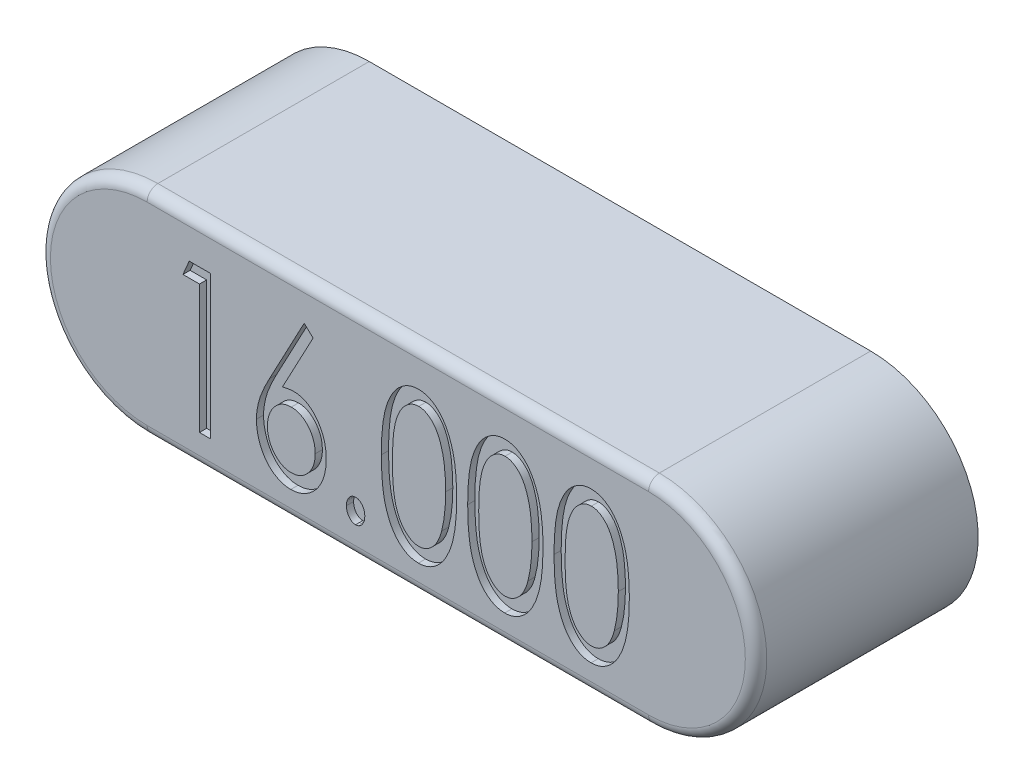
from build123d import *

# Parameters (mm, degrees)
BOSS_EXTRU_1_DEPTH      = 3.1
CONG_1_R                = 0.15
ENL_V_MAT_EXTRU_1_DEPTH = 0.1


with BuildPart() as part:
    # Esquisse1 → Boss.-Extru.1 (new body)
    with BuildSketch(Plane.XY):
        with BuildLine():
            Line((-3.5, 1.5), (3.5, 1.5))
            ThreePointArc((3.5, 1.5), (5, 0), (3.5, -1.5))
            Line((3.5, -1.5), (-3.5, -1.5))
            ThreePointArc((-3.5, -1.5), (-5, 0), (-3.5, 1.5))
        make_face()
    extrude(amount=BOSS_EXTRU_1_DEPTH)

    # Congé1
    cong_1_edges = [part.edges().sort_by_distance(p)[0] for p in [
        (5, 0, 3.1),
        (0, 1.5, 3.1),
        (-5, 0, 3.1),
        (0, -1.5, 3.1),
    ]]
    fillet(cong_1_edges, radius=CONG_1_R)

    # Esquisse2 → Enlèv. mat.-Extru.1 (cut)
    # profile 1 of 6: a face of its own
    with BuildSketch(Plane.XY.offset(3.1)):
        Polygon((-2.912259615, 0.930524366), (-2.615384615, 0.930524366), (-2.615384615, -1.069475634), (-2.769230769, -1.069475634), (-2.769230769, 0.725396161), (-3, 0.725396161), align=None)
    # profile 2 of 6: a face of its own
    with BuildSketch(Plane.XY.offset(3.1)):
        with BuildLine():
            Line((-1.307692308, 0.981806417), (-1.18349359, 0.864819238))
            Line((-1.18349359, 0.864819238), (-1.611778846, 0.059530776))
            add(Edge.make_bspline(
                [(-1.611778846, 0.059530776), (-1.597928908, 0.063290971), (-1.57080734, 0.070654352), (-1.530316189, 0.078859667), (-1.490751869, 0.083287154), (-1.464753301, 0.084012543), (-1.451923077, 0.08437052)],
                knots=[0, 0, 0, 0, 1.060929787, 2.077560185, 3.051281057, 4, 4, 4, 4], degree=3))
            add(Edge.make_bspline(
                [(-1.451923077, 0.08437052), (-1.436395077, 0.083823186), (-1.405796534, 0.082744643), (-1.360996018, 0.074440897), (-1.317979302, 0.061238797), (-1.276929721, 0.042085793), (-1.237486989, 0.017974526), (-1.199910734, -0.011674731), (-1.164291733, -0.046676576), (-1.130905893, -0.086633183), (-1.1003596, -0.130333468), (-1.073282455, -0.176863233), (-1.051006845, -0.226156239), (-1.031859912, -0.27755602), (-1.017498053, -0.331780281), (-1.007812544, -0.388522634), (-1.000953164, -0.447514582), (-1.00032137, -0.487724375), (-1, -0.508177557)],
                knots=[0, 0, 0, 0, 0.901205013, 1.775860311, 2.636794131, 3.507728647, 4.39883402, 5.315685146, 6.280851143, 7.293630634, 8.33489768, 9.373736179, 10.414743294, 11.472171862, 12.555667919, 13.666163363, 14.812866618, 16, 16, 16, 16], degree=3))
            add(Edge.make_bspline(
                [(-1, -0.508177557), (-1.0007265, -0.536136644), (-1.002151756, -0.590987107), (-1.014610645, -0.670985406), (-1.034016283, -0.747191508), (-1.062116334, -0.818436072), (-1.096679504, -0.884517409), (-1.138789477, -0.94363876), (-1.187547363, -0.995687146), (-1.242264715, -1.040061564), (-1.301420233, -1.075822064), (-1.363712467, -1.101873665), (-1.428572353, -1.117683073), (-1.472671307, -1.119730621), (-1.494791667, -1.120757685)],
                knots=[0, 0, 0, 0, 1.1494067, 2.254919458, 3.322155787, 4.377964422, 5.397776209, 6.382466747, 7.354045797, 8.32263862, 9.271321606, 10.187430282, 11.090801708, 12, 12, 12, 12], degree=3))
            add(Edge.make_bspline(
                [(-1.494791667, -1.120757685), (-1.516248987, -1.119893133), (-1.558757205, -1.118180403), (-1.621133397, -1.102527391), (-1.680863317, -1.07737479), (-1.737845052, -1.042871974), (-1.79033411, -0.999083768), (-1.837141275, -0.946681866), (-1.8781977, -0.886485515), (-1.912693623, -0.818990005), (-1.939971184, -0.746329722), (-1.959627687, -0.67031336), (-1.972134161, -0.59192464), (-1.97361248, -0.538673221), (-1.974358974, -0.511783326)],
                knots=[0, 0, 0, 0, 0.896664654, 1.776345551, 2.673079863, 3.600831316, 4.55320042, 5.522713429, 6.531813274, 7.594061508, 8.687030288, 9.772760072, 10.875330519, 12, 12, 12, 12], degree=3))
            add(Edge.make_bspline(
                [(-1.974358974, -0.511783326), (-1.973908663, -0.491194414), (-1.972990466, -0.449213115), (-1.964915054, -0.385628312), (-1.952435643, -0.320472169), (-1.934913788, -0.252807089), (-1.910935911, -0.180965122), (-1.878612722, -0.103564516), (-1.839513869, -0.018921149), (-1.808918787, 0.038843036), (-1.79286859, 0.069146161)],
                knots=[0, 0, 0, 0, 0.803132881, 1.63760775, 2.497139017, 3.390748782, 4.363024246, 5.449780174, 6.662153211, 8, 8, 8, 8], degree=3))
            Line((-1.79286859, 0.069146161), (-1.307692308, 0.981806417))
        make_face()
        with BuildLine():
            add(Edge.make_bspline(
                [(-1.487179487, -0.120757685), (-1.498547668, -0.121199377), (-1.52086876, -0.122066626), (-1.553887307, -0.12726169), (-1.585363377, -0.136644451), (-1.615926525, -0.149010427), (-1.644800356, -0.165736567), (-1.672584442, -0.185736864), (-1.698714808, -0.209838797), (-1.723631875, -0.236653675), (-1.746540205, -0.266147466), (-1.765932663, -0.297939868), (-1.783086863, -0.330855512), (-1.796585801, -0.365585147), (-1.807558617, -0.401704667), (-1.815069849, -0.439411738), (-1.819548224, -0.478688686), (-1.82018654, -0.505361057), (-1.820512821, -0.518994865)],
                knots=[0, 0, 0, 0, 0.946268867, 1.857971231, 2.772378949, 3.674274847, 4.595075925, 5.54206238, 6.517636006, 7.547827487, 8.585901374, 9.619025919, 10.642903972, 11.670634825, 12.714877187, 13.780659826, 14.865565546, 16, 16, 16, 16], degree=3))
            add(Edge.make_bspline(
                [(-1.820512821, -0.518994865), (-1.820190003, -0.532496), (-1.819558583, -0.558903747), (-1.815018142, -0.597901321), (-1.807636957, -0.635374592), (-1.796484507, -0.671302006), (-1.783203453, -0.705857083), (-1.76580999, -0.738517907), (-1.746557162, -0.770248932), (-1.723625671, -0.799727857), (-1.69872246, -0.826561282), (-1.672561444, -0.85060729), (-1.644934681, -0.870765193), (-1.615706736, -0.886791849), (-1.585481527, -0.899881014), (-1.553869055, -0.90908468), (-1.520873519, -0.914331178), (-1.498549275, -0.915191378), (-1.487179487, -0.91562948)],
                knots=[0, 0, 0, 0, 1.126413976, 2.203226288, 3.27193519, 4.308375719, 5.338928357, 6.355711774, 7.391672913, 8.432596984, 9.465617006, 10.443869212, 11.393455756, 12.311321693, 13.22000908, 14.136927438, 15.051133013, 16, 16, 16, 16], degree=3))
            add(Edge.make_bspline(
                [(-1.487179487, -0.91562948), (-1.475811589, -0.91518575), (-1.453491053, -0.914314498), (-1.420595486, -0.909168517), (-1.389083992, -0.899688132), (-1.358812993, -0.88701544), (-1.329750225, -0.870641367), (-1.302189255, -0.850481251), (-1.275636518, -0.826830561), (-1.251146695, -0.799582514), (-1.22824051, -0.770149978), (-1.208487633, -0.738637771), (-1.191181015, -0.705841693), (-1.177867561, -0.671306175), (-1.166723936, -0.635373435), (-1.159340311, -0.597901636), (-1.15480053, -0.558903664), (-1.154169018, -0.532495972), (-1.153846154, -0.518994865)],
                knots=[0, 0, 0, 0, 0.949074805, 1.863480608, 2.76990316, 3.689052114, 4.597391575, 5.547186095, 6.533934344, 7.559637911, 8.600789962, 9.642896214, 10.659902324, 11.690680672, 12.727348199, 13.796291166, 14.87333932, 16, 16, 16, 16], degree=3))
            add(Edge.make_bspline(
                [(-1.153846154, -0.518994865), (-1.154172482, -0.505361086), (-1.15481089, -0.478688771), (-1.159288599, -0.43941142), (-1.16680228, -0.401705828), (-1.177766199, -0.365580936), (-1.19129766, -0.330870939), (-1.208363527, -0.297819178), (-1.228257402, -0.266246379), (-1.251140542, -0.236799056), (-1.275644221, -0.209569491), (-1.302165749, -0.185862376), (-1.329885659, -0.165859651), (-1.358592828, -0.148787188), (-1.389200047, -0.136834877), (-1.420577543, -0.1271783), (-1.453495755, -0.12208324), (-1.475813175, -0.121204984), (-1.487179487, -0.120757685)],
                knots=[0, 0, 0, 0, 1.134674697, 2.21981017, 3.285818513, 4.330282017, 5.358230516, 6.382325399, 7.421570703, 8.459864426, 9.482752076, 10.466791355, 11.413978355, 12.325331643, 13.237701197, 14.141635301, 15.053530739, 16, 16, 16, 16], degree=3))
        make_face(mode=Mode.SUBTRACT)
    # profile 3 of 6: a face of its own
    with BuildSketch(Plane.XY.offset(3.1)):
        with BuildLine():
            add(Edge.make_bspline(
                [(-0.58974359, -0.761783326), (-0.581123113, -0.762443269), (-0.564086626, -0.763747501), (-0.539531636, -0.772992058), (-0.517565815, -0.78886606), (-0.498202002, -0.810156431), (-0.482075792, -0.835546443), (-0.469642782, -0.863958906), (-0.462939804, -0.89542371), (-0.4620157, -0.917202623), (-0.461538462, -0.928449993)],
                knots=[0, 0, 0, 0, 0.888235515, 1.755403159, 2.664739847, 3.658771767, 4.705496901, 5.754303631, 6.840246125, 8, 8, 8, 8], degree=3))
            add(Edge.make_bspline(
                [(-0.461538462, -0.928449993), (-0.462033703, -0.939427849), (-0.463003918, -0.960934279), (-0.46962265, -0.992151355), (-0.482191598, -1.02061416), (-0.498072405, -1.046283442), (-0.517563963, -1.067665176), (-0.539618944, -1.083402668), (-0.563994713, -1.093265343), (-0.581108259, -1.094495789), (-0.58974359, -1.09511666)],
                knots=[0, 0, 0, 0, 1.133833385, 2.221263238, 3.271506465, 4.33130329, 5.326696684, 6.237278843, 7.110547914, 8, 8, 8, 8], degree=3))
            add(Edge.make_bspline(
                [(-0.58974359, -1.09511666), (-0.598383178, -1.094501776), (-0.615505164, -1.093283196), (-0.639920517, -1.083289415), (-0.662304833, -1.067819227), (-0.681769076, -1.046249295), (-0.697800478, -1.02071797), (-0.709748667, -0.992045599), (-0.716517066, -0.960948861), (-0.7174649, -0.939432777), (-0.717948718, -0.928449993)],
                knots=[0, 0, 0, 0, 0.888790314, 1.761409654, 2.682617918, 3.677270718, 4.73627903, 5.78038943, 6.867010211, 8, 8, 8, 8], degree=3))
            add(Edge.make_bspline(
                [(-0.717948718, -0.928449993), (-0.717483324, -0.917197514), (-0.716582156, -0.895408708), (-0.709728509, -0.864064667), (-0.697914313, -0.835443547), (-0.681639779, -0.810190286), (-0.66230316, -0.788712007), (-0.6400088, -0.773103073), (-0.615413297, -0.763729497), (-0.598368348, -0.76243722), (-0.58974359, -0.761783326)],
                knots=[0, 0, 0, 0, 1.158892172, 2.244027806, 3.286711158, 4.33265857, 5.32595192, 6.245901114, 7.112424448, 8, 8, 8, 8], degree=3))
        make_face()
    # profile 4 of 6: a face of its own
    with BuildSketch(Plane.XY.offset(3.1)):
        with BuildLine():
            add(Edge.make_bspline(
                [(-0.230769231, -0.070276916), (-0.230474041, -0.038224399), (-0.229900769, 0.024023022), (-0.227325681, 0.114747379), (-0.222082415, 0.19984573), (-0.214965122, 0.279352934), (-0.205833695, 0.353130467), (-0.194712439, 0.421316523), (-0.181602846, 0.483916277), (-0.166368729, 0.541305017), (-0.148839801, 0.594118989), (-0.130311421, 0.643519845), (-0.109197208, 0.68937324), (-0.086957603, 0.73208806), (-0.0632601, 0.771725069), (-0.037764758, 0.807961446), (-0.009737823, 0.840280268), (0.018789809, 0.870290463), (0.049436254, 0.895982359), (0.080269299, 0.91926715), (0.112490083, 0.938624782), (0.145791303, 0.954062328), (0.179588951, 0.966785605), (0.214375425, 0.975605152), (0.250096609, 0.980981758), (0.274286828, 0.981530376), (0.286458333, 0.981806417)],
                knots=[0, 0, 0, 0, 1.781901398, 3.460532095, 5.044788518, 6.520804026, 7.897452363, 9.176538264, 10.360312765, 11.451616863, 12.475215169, 13.452762962, 14.382988646, 15.279574158, 16.128804228, 16.948678406, 17.738629264, 18.505137989, 19.247576026, 19.958810054, 20.651434701, 21.332261274, 21.996989992, 22.656014566, 23.323762819, 24, 24, 24, 24], degree=3))
            add(Edge.make_bspline(
                [(0.286458333, 0.981806417), (0.298762963, 0.981525699), (0.323350436, 0.980964761), (0.359730982, 0.97559432), (0.395211685, 0.966861046), (0.429517191, 0.954052873), (0.463243244, 0.938657556), (0.495862586, 0.919122873), (0.527619541, 0.896188666), (0.558332067, 0.869683251), (0.588278699, 0.839993784), (0.616141899, 0.806337369), (0.642115369, 0.769121056), (0.667269704, 0.728947461), (0.690200888, 0.684864132), (0.711958668, 0.637430776), (0.731892982, 0.586431172), (0.75043375, 0.531817858), (0.766880081, 0.472975065), (0.781190339, 0.409578105), (0.793631441, 0.341431017), (0.803561565, 0.268435077), (0.810993083, 0.190502091), (0.816645047, 0.107811556), (0.81975083, 0.020291786), (0.820254377, -0.039558828), (0.820512821, -0.070276916)],
                knots=[0, 0, 0, 0, 0.680015622, 1.358827319, 2.028662734, 2.696786366, 3.380680169, 4.075961124, 4.795334018, 5.544232778, 6.317033788, 7.124480586, 7.956310745, 8.825174656, 9.743468946, 10.701748025, 11.709644056, 12.76982753, 13.889669025, 15.086322274, 16.362388274, 17.718987041, 19.158433838, 20.690516929, 22.301421041, 24, 24, 24, 24], degree=3))
            add(Edge.make_bspline(
                [(0.820512821, -0.070276916), (0.820268425, -0.100862364), (0.819792302, -0.16044773), (0.816493887, -0.247545999), (0.811521084, -0.329870804), (0.803959205, -0.407389783), (0.793946241, -0.479944781), (0.781918533, -0.54783589), (0.768226441, -0.61105659), (0.751641789, -0.669577198), (0.733001738, -0.723694285), (0.713563922, -0.774563749), (0.691809097, -0.821820457), (0.668732844, -0.865941267), (0.643871249, -0.906523818), (0.617344, -0.943716027), (0.588942719, -0.977221793), (0.559295974, -1.007463697), (0.528230057, -1.03399666), (0.49646204, -1.057241223), (0.463527393, -1.076696729), (0.429927832, -1.092789073), (0.395306298, -1.105337064), (0.359700197, -1.114032606), (0.323387547, -1.120042905), (0.298768797, -1.120519411), (0.286458333, -1.120757685)],
                knots=[0, 0, 0, 0, 1.693248669, 3.298720394, 4.82480384, 6.258640445, 7.609562187, 8.878591748, 10.075077288, 11.189162254, 12.243632055, 13.243172686, 14.20261538, 15.122024733, 15.998236071, 16.835364342, 17.64854462, 18.427529536, 19.177337665, 19.907907745, 20.604032963, 21.291903361, 21.967788968, 22.638437747, 23.319158652, 24, 24, 24, 24], degree=3))
            add(Edge.make_bspline(
                [(0.286458333, -1.120757685), (0.274285631, -1.120490882), (0.250225251, -1.119963521), (0.214522416, -1.114477353), (0.17978066, -1.105723578), (0.14591644, -1.093493428), (0.112750732, -1.078478613), (0.081119766, -1.058697557), (0.049852519, -1.036476497), (0.019667589, -1.010630587), (-0.009128207, -0.98151146), (-0.036074448, -0.948610477), (-0.061765232, -0.9125463), (-0.08565008, -0.872994927), (-0.10769828, -0.830040979), (-0.128736215, -0.78407815), (-0.147147523, -0.734194198), (-0.165209665, -0.681079961), (-0.18077863, -0.623270996), (-0.194420678, -0.560317626), (-0.205395991, -0.491804816), (-0.214422135, -0.418012717), (-0.222240127, -0.33882441), (-0.227280257, -0.254095372), (-0.229909133, -0.163910288), (-0.230477253, -0.102062723), (-0.230769231, -0.070276916)],
                knots=[0, 0, 0, 0, 0.677096952, 1.338339662, 2.005406211, 2.668443115, 3.340255766, 4.027397533, 4.741163398, 5.474065193, 6.236238345, 7.017634829, 7.838551399, 8.699067334, 9.586765462, 10.524942004, 11.510680007, 12.54497159, 13.646778121, 14.840882375, 16.128929706, 17.507328321, 18.978512682, 20.55736376, 22.230698808, 24, 24, 24, 24], degree=3))
        make_face()
        with BuildLine():
            add(Edge.make_bspline(
                [(-0.076923077, -0.069475634), (-0.07673755, -0.096185838), (-0.076377576, -0.148011256), (-0.074514557, -0.223358014), (-0.070839305, -0.293612484), (-0.06619436, -0.358828298), (-0.059860058, -0.418972591), (-0.051860858, -0.474149384), (-0.042759225, -0.52429389), (-0.032316203, -0.569786533), (-0.020255431, -0.611383299), (-0.006504203, -0.649946531), (0.008195613, -0.68597737), (0.024220335, -0.719521268), (0.04192703, -0.750343808), (0.060628192, -0.778838648), (0.080788143, -0.804774429), (0.108986226, -0.83489419), (0.145759252, -0.866655444), (0.192916203, -0.89453742), (0.24156396, -0.912241886), (0.27483534, -0.914509597), (0.291266026, -0.91562948)],
                knots=[0, 0, 0, 0, 1.585253382, 3.075843952, 4.472619842, 5.760128673, 6.955753547, 8.06095077, 9.068316143, 9.979618947, 10.829906407, 11.637100979, 12.408357834, 13.138614022, 13.841518553, 14.516382118, 15.160087741, 15.788184859, 16.963380614, 18.029108162, 19.026697924, 20, 20, 20, 20], degree=3))
            add(Edge.make_bspline(
                [(0.291266026, -0.91562948), (0.307838889, -0.914695182), (0.341276709, -0.912810118), (0.389629906, -0.8949691), (0.43638352, -0.867927089), (0.472479108, -0.83676057), (0.5001326, -0.807170794), (0.520010708, -0.781578846), (0.538214817, -0.753137518), (0.555416558, -0.722206592), (0.571720432, -0.688782825), (0.585775022, -0.652312701), (0.599199523, -0.613336894), (0.606715719, -0.58621376), (0.610576923, -0.572280121)],
                knots=[0, 0, 0, 0, 1.179950538, 2.380697451, 3.63736744, 5.024996919, 5.767521967, 6.528927784, 7.335999231, 8.177356486, 9.056327879, 9.989928685, 10.967390406, 12, 12, 12, 12], degree=3))
            add(Edge.make_bspline(
                [(0.610576923, -0.572280121), (0.615156046, -0.55442452), (0.624472529, -0.518096291), (0.635460857, -0.461742143), (0.645034226, -0.402948779), (0.653166832, -0.341510098), (0.65900301, -0.277342738), (0.663365769, -0.210414236), (0.666332226, -0.140816385), (0.666553961, -0.093517225), (0.666666667, -0.069475634)],
                knots=[0, 0, 0, 0, 0.8718959, 1.773921478, 2.714952333, 3.689817886, 4.705117713, 5.762496763, 6.862704138, 8, 8, 8, 8], degree=3))
            add(Edge.make_bspline(
                [(0.666666667, -0.069475634), (0.666514887, -0.04543552), (0.666217995, 0.001588811), (0.663845848, 0.070394625), (0.659674861, 0.135827953), (0.654849267, 0.198017104), (0.647345479, 0.256741752), (0.639314604, 0.312306898), (0.628614562, 0.364328192), (0.617281343, 0.413352745), (0.60389425, 0.45881603), (0.590021525, 0.50134345), (0.574374009, 0.54048747), (0.557651146, 0.576679437), (0.539535265, 0.609493906), (0.520836273, 0.639519813), (0.500341447, 0.666008965), (0.472095546, 0.696243498), (0.435313587, 0.727539901), (0.38904814, 0.756180368), (0.340478053, 0.773151342), (0.307545822, 0.775511491), (0.291266026, 0.776678212)],
                knots=[0, 0, 0, 0, 1.427519131, 2.792338422, 4.087386796, 5.320879155, 6.495321347, 7.602283647, 8.653622338, 9.64806089, 10.589215667, 11.466924906, 12.303360749, 13.090967005, 13.832724313, 14.527915986, 15.189360817, 15.817798831, 16.982454729, 18.045985158, 19.034047716, 20, 20, 20, 20], degree=3))
            add(Edge.make_bspline(
                [(0.291266026, 0.776678212), (0.274717547, 0.775525135), (0.241386837, 0.773202695), (0.192305804, 0.75618145), (0.145672523, 0.727665065), (0.108966317, 0.696377285), (0.081071352, 0.666471158), (0.061054256, 0.640675695), (0.042256702, 0.612308836), (0.025108859, 0.581246909), (0.008961616, 0.547846643), (-0.005685417, 0.511789271), (-0.019488637, 0.473242339), (-0.031393515, 0.431576139), (-0.042514711, 0.386211788), (-0.051362001, 0.336114848), (-0.05957319, 0.280970928), (-0.065645371, 0.220654519), (-0.070970271, 0.155350209), (-0.074490385, 0.084938174), (-0.076385799, 0.009461392), (-0.076740365, -0.04263161), (-0.076923077, -0.069475634)],
                knots=[0, 0, 0, 0, 0.981108698, 1.976075909, 3.045759451, 4.209702925, 4.826555694, 5.470216713, 6.145033515, 6.843991151, 7.574196738, 8.345400151, 9.15253879, 10.002767331, 10.915831776, 11.923127346, 13.020405197, 14.223828133, 15.519757537, 16.90852172, 18.406931538, 20, 20, 20, 20], degree=3))
        make_face(mode=Mode.SUBTRACT)
    # profile 5 of 6: a face of its own
    with BuildSketch(Plane.XY.offset(3.1)):
        with BuildLine():
            add(Edge.make_bspline(
                [(0.974358974, -0.070276916), (0.974654164, -0.038224399), (0.975227436, 0.024023022), (0.977802524, 0.114747379), (0.98304579, 0.19984573), (0.990163083, 0.279352934), (0.99929451, 0.353130467), (1.010415766, 0.421316523), (1.023525359, 0.483916277), (1.038759477, 0.541305017), (1.056288404, 0.594118989), (1.074816785, 0.643519845), (1.095930997, 0.68937324), (1.118170602, 0.73208806), (1.141868105, 0.771725069), (1.167363448, 0.807961446), (1.195390382, 0.840280268), (1.223918014, 0.870290463), (1.25456446, 0.895982359), (1.285397504, 0.91926715), (1.317618288, 0.938624782), (1.350919509, 0.954062328), (1.384717156, 0.966785605), (1.41950363, 0.975605152), (1.455224814, 0.980981758), (1.479415033, 0.981530376), (1.491586538, 0.981806417)],
                knots=[0, 0, 0, 0, 1.781901398, 3.460532095, 5.044788518, 6.520804026, 7.897452363, 9.176538264, 10.360312765, 11.451616863, 12.475215169, 13.452762962, 14.382988646, 15.279574158, 16.128804228, 16.948678406, 17.738629264, 18.505137989, 19.247576026, 19.958810054, 20.651434701, 21.332261274, 21.996989992, 22.656014566, 23.323762819, 24, 24, 24, 24], degree=3))
            add(Edge.make_bspline(
                [(1.491586538, 0.981806417), (1.503891168, 0.981525699), (1.528478641, 0.980964761), (1.564859187, 0.97559432), (1.60033989, 0.966861046), (1.634645396, 0.954052873), (1.668371449, 0.938657556), (1.700990791, 0.919122873), (1.732747746, 0.896188666), (1.763460272, 0.869683251), (1.793406904, 0.839993784), (1.821270104, 0.806337369), (1.847243574, 0.769121056), (1.872397909, 0.728947461), (1.895329094, 0.684864132), (1.917086873, 0.637430776), (1.937021187, 0.586431172), (1.955561955, 0.531817858), (1.972008286, 0.472975065), (1.986318545, 0.409578105), (1.998759646, 0.341431017), (2.00868977, 0.268435077), (2.016121288, 0.190502091), (2.021773252, 0.107811556), (2.024879035, 0.020291786), (2.025382582, -0.039558828), (2.025641026, -0.070276916)],
                knots=[0, 0, 0, 0, 0.680015622, 1.358827319, 2.028662734, 2.696786366, 3.380680169, 4.075961124, 4.795334018, 5.544232778, 6.317033788, 7.124480586, 7.956310745, 8.825174656, 9.743468946, 10.701748025, 11.709644056, 12.76982753, 13.889669025, 15.086322274, 16.362388274, 17.718987041, 19.158433838, 20.690516929, 22.301421041, 24, 24, 24, 24], degree=3))
            add(Edge.make_bspline(
                [(2.025641026, -0.070276916), (2.02539663, -0.100862364), (2.024920507, -0.16044773), (2.021622092, -0.247545999), (2.016649289, -0.329870804), (2.00908741, -0.407389783), (1.999074446, -0.479944781), (1.987046738, -0.54783589), (1.973354647, -0.61105659), (1.956769994, -0.669577198), (1.938129943, -0.723694285), (1.918692127, -0.774563749), (1.896937302, -0.821820457), (1.873861049, -0.865941267), (1.848999454, -0.906523818), (1.822472205, -0.943716027), (1.794070924, -0.977221793), (1.764424179, -1.007463697), (1.733358262, -1.03399666), (1.701590245, -1.057241223), (1.668655598, -1.076696729), (1.635056037, -1.092789073), (1.600434504, -1.105337064), (1.564828402, -1.114032606), (1.528515752, -1.120042905), (1.503897002, -1.120519411), (1.491586538, -1.120757685)],
                knots=[0, 0, 0, 0, 1.693248669, 3.298720394, 4.82480384, 6.258640445, 7.609562187, 8.878591748, 10.075077288, 11.189162254, 12.243632055, 13.243172686, 14.20261538, 15.122024733, 15.998236071, 16.835364342, 17.64854462, 18.427529536, 19.177337665, 19.907907745, 20.604032963, 21.291903361, 21.967788968, 22.638437747, 23.319158652, 24, 24, 24, 24], degree=3))
            add(Edge.make_bspline(
                [(1.491586538, -1.120757685), (1.479413836, -1.120490882), (1.455353456, -1.119963521), (1.419650621, -1.114477353), (1.384908865, -1.105723578), (1.351044645, -1.093493428), (1.317878937, -1.078478613), (1.286247971, -1.058697557), (1.254980724, -1.036476497), (1.224795794, -1.010630587), (1.195999998, -0.98151146), (1.169053757, -0.948610477), (1.143362973, -0.9125463), (1.119478125, -0.872994927), (1.097429925, -0.830040979), (1.076391991, -0.78407815), (1.057980682, -0.734194198), (1.03991854, -0.681079961), (1.024349575, -0.623270996), (1.010707527, -0.560317626), (0.999732215, -0.491804816), (0.99070607, -0.418012717), (0.982888078, -0.33882441), (0.977847949, -0.254095372), (0.975219072, -0.163910288), (0.974650952, -0.102062723), (0.974358974, -0.070276916)],
                knots=[0, 0, 0, 0, 0.677096952, 1.338339662, 2.005406211, 2.668443115, 3.340255766, 4.027397533, 4.741163398, 5.474065193, 6.236238345, 7.017634829, 7.838551399, 8.699067334, 9.586765462, 10.524942004, 11.510680007, 12.54497159, 13.646778121, 14.840882375, 16.128929706, 17.507328321, 18.978512682, 20.55736376, 22.230698808, 24, 24, 24, 24], degree=3))
        make_face()
        with BuildLine():
            add(Edge.make_bspline(
                [(1.128205128, -0.069475634), (1.128390655, -0.096185838), (1.128750629, -0.148011256), (1.130613648, -0.223358014), (1.1342889, -0.293612484), (1.138933845, -0.358828298), (1.145268147, -0.418972591), (1.153267348, -0.474149384), (1.16236898, -0.52429389), (1.172812002, -0.569786533), (1.184872774, -0.611383299), (1.198624002, -0.649946531), (1.213323818, -0.68597737), (1.22934854, -0.719521268), (1.247055235, -0.750343808), (1.265756398, -0.778838648), (1.285916348, -0.804774429), (1.314114431, -0.83489419), (1.350887457, -0.866655444), (1.398044409, -0.89453742), (1.446692165, -0.912241886), (1.479963545, -0.914509597), (1.496394231, -0.91562948)],
                knots=[0, 0, 0, 0, 1.585253382, 3.075843952, 4.472619842, 5.760128673, 6.955753547, 8.06095077, 9.068316143, 9.979618947, 10.829906407, 11.637100979, 12.408357834, 13.138614022, 13.841518553, 14.516382118, 15.160087741, 15.788184859, 16.963380614, 18.029108162, 19.026697924, 20, 20, 20, 20], degree=3))
            add(Edge.make_bspline(
                [(1.496394231, -0.91562948), (1.512967094, -0.914695182), (1.546404914, -0.912810118), (1.594758111, -0.8949691), (1.641511725, -0.867927089), (1.677607313, -0.83676057), (1.705260805, -0.807170794), (1.725138914, -0.781578846), (1.743343022, -0.753137518), (1.760544763, -0.722206592), (1.776848637, -0.688782825), (1.790903228, -0.652312701), (1.804327728, -0.613336894), (1.811843924, -0.58621376), (1.815705128, -0.572280121)],
                knots=[0, 0, 0, 0, 1.179950538, 2.380697451, 3.63736744, 5.024996919, 5.767521967, 6.528927784, 7.335999231, 8.177356486, 9.056327879, 9.989928685, 10.967390406, 12, 12, 12, 12], degree=3))
            add(Edge.make_bspline(
                [(1.815705128, -0.572280121), (1.820284251, -0.55442452), (1.829600734, -0.518096291), (1.840589062, -0.461742143), (1.850162431, -0.402948779), (1.858295037, -0.341510098), (1.864131215, -0.277342738), (1.868493974, -0.210414236), (1.871460431, -0.140816385), (1.871682167, -0.093517225), (1.871794872, -0.069475634)],
                knots=[0, 0, 0, 0, 0.8718959, 1.773921478, 2.714952333, 3.689817886, 4.705117713, 5.762496763, 6.862704138, 8, 8, 8, 8], degree=3))
            add(Edge.make_bspline(
                [(1.871794872, -0.069475634), (1.871643092, -0.04543552), (1.8713462, 0.001588811), (1.868974053, 0.070394625), (1.864803066, 0.135827953), (1.859977472, 0.198017104), (1.852473685, 0.256741752), (1.844442809, 0.312306898), (1.833742768, 0.364328192), (1.822409548, 0.413352745), (1.809022455, 0.45881603), (1.79514973, 0.50134345), (1.779502214, 0.54048747), (1.762779351, 0.576679437), (1.74466347, 0.609493906), (1.725964478, 0.639519813), (1.705469652, 0.666008965), (1.677223752, 0.696243498), (1.640441793, 0.727539901), (1.594176345, 0.756180368), (1.545606258, 0.773151342), (1.512674027, 0.775511491), (1.496394231, 0.776678212)],
                knots=[0, 0, 0, 0, 1.427519131, 2.792338422, 4.087386796, 5.320879155, 6.495321347, 7.602283647, 8.653622338, 9.64806089, 10.589215667, 11.466924906, 12.303360749, 13.090967005, 13.832724313, 14.527915986, 15.189360817, 15.817798831, 16.982454729, 18.045985158, 19.034047716, 20, 20, 20, 20], degree=3))
            add(Edge.make_bspline(
                [(1.496394231, 0.776678212), (1.479845752, 0.775525135), (1.446515042, 0.773202695), (1.397434009, 0.75618145), (1.350800728, 0.727665065), (1.314094522, 0.696377285), (1.286199557, 0.666471158), (1.266182461, 0.640675695), (1.247384907, 0.612308836), (1.230237064, 0.581246909), (1.214089821, 0.547846643), (1.199442789, 0.511789271), (1.185639568, 0.473242339), (1.17373469, 0.431576139), (1.162613495, 0.386211788), (1.153766204, 0.336114848), (1.145555015, 0.280970928), (1.139482834, 0.220654519), (1.134157935, 0.155350209), (1.13063782, 0.084938174), (1.128742406, 0.009461392), (1.12838784, -0.04263161), (1.128205128, -0.069475634)],
                knots=[0, 0, 0, 0, 0.981108698, 1.976075909, 3.045759451, 4.209702925, 4.826555694, 5.470216713, 6.145033515, 6.843991151, 7.574196738, 8.345400151, 9.15253879, 10.002767331, 10.915831776, 11.923127346, 13.020405197, 14.223828133, 15.519757537, 16.90852172, 18.406931538, 20, 20, 20, 20], degree=3))
        make_face(mode=Mode.SUBTRACT)
    # profile 6 of 6: a face of its own
    with BuildSketch(Plane.XY.offset(3.1)):
        with BuildLine():
            add(Edge.make_bspline(
                [(2.179487179, -0.070276916), (2.179782369, -0.038224399), (2.180355641, 0.024023022), (2.182930729, 0.114747379), (2.188173995, 0.19984573), (2.195291288, 0.279352934), (2.204422715, 0.353130467), (2.215543971, 0.421316523), (2.228653564, 0.483916277), (2.243887682, 0.541305017), (2.26141661, 0.594118989), (2.27994499, 0.643519845), (2.301059202, 0.68937324), (2.323298807, 0.73208806), (2.34699631, 0.771725069), (2.372491653, 0.807961446), (2.400518587, 0.840280268), (2.429046219, 0.870290463), (2.459692665, 0.895982359), (2.490525709, 0.91926715), (2.522746493, 0.938624782), (2.556047714, 0.954062328), (2.589845361, 0.966785605), (2.624631835, 0.975605152), (2.660353019, 0.980981758), (2.684543238, 0.981530376), (2.696714744, 0.981806417)],
                knots=[0, 0, 0, 0, 1.781901398, 3.460532095, 5.044788518, 6.520804026, 7.897452363, 9.176538264, 10.360312765, 11.451616863, 12.475215169, 13.452762962, 14.382988646, 15.279574158, 16.128804228, 16.948678406, 17.738629264, 18.505137989, 19.247576026, 19.958810054, 20.651434701, 21.332261274, 21.996989992, 22.656014566, 23.323762819, 24, 24, 24, 24], degree=3))
            add(Edge.make_bspline(
                [(2.696714744, 0.981806417), (2.709019373, 0.981525699), (2.733606847, 0.980964761), (2.769987392, 0.97559432), (2.805468095, 0.966861046), (2.839773601, 0.954052873), (2.873499655, 0.938657556), (2.906118996, 0.919122873), (2.937875951, 0.896188666), (2.968588477, 0.869683251), (2.998535109, 0.839993784), (3.026398309, 0.806337369), (3.052371779, 0.769121056), (3.077526115, 0.728947461), (3.100457299, 0.684864132), (3.122215078, 0.637430776), (3.142149392, 0.586431172), (3.16069016, 0.531817858), (3.177136491, 0.472975065), (3.19144675, 0.409578105), (3.203887851, 0.341431017), (3.213817975, 0.268435077), (3.221249493, 0.190502091), (3.226901457, 0.107811556), (3.230007241, 0.020291786), (3.230510787, -0.039558828), (3.230769231, -0.070276916)],
                knots=[0, 0, 0, 0, 0.680015622, 1.358827319, 2.028662734, 2.696786366, 3.380680169, 4.075961124, 4.795334018, 5.544232778, 6.317033788, 7.124480586, 7.956310745, 8.825174656, 9.743468946, 10.701748025, 11.709644056, 12.76982753, 13.889669025, 15.086322274, 16.362388274, 17.718987041, 19.158433838, 20.690516929, 22.301421041, 24, 24, 24, 24], degree=3))
            add(Edge.make_bspline(
                [(3.230769231, -0.070276916), (3.230524835, -0.100862364), (3.230048712, -0.16044773), (3.226750298, -0.247545999), (3.221777495, -0.329870804), (3.214215615, -0.407389783), (3.204202651, -0.479944781), (3.192174943, -0.54783589), (3.178482852, -0.61105659), (3.161898199, -0.669577198), (3.143258148, -0.723694285), (3.123820332, -0.774563749), (3.102065507, -0.821820457), (3.078989254, -0.865941267), (3.054127659, -0.906523818), (3.02760041, -0.943716027), (2.999199129, -0.977221793), (2.969552384, -1.007463697), (2.938486467, -1.03399666), (2.90671845, -1.057241223), (2.873783803, -1.076696729), (2.840184242, -1.092789073), (2.805562709, -1.105337064), (2.769956607, -1.114032606), (2.733643957, -1.120042905), (2.709025207, -1.120519411), (2.696714744, -1.120757685)],
                knots=[0, 0, 0, 0, 1.693248669, 3.298720394, 4.82480384, 6.258640445, 7.609562187, 8.878591748, 10.075077288, 11.189162254, 12.243632055, 13.243172686, 14.20261538, 15.122024733, 15.998236071, 16.835364342, 17.64854462, 18.427529536, 19.177337665, 19.907907745, 20.604032963, 21.291903361, 21.967788968, 22.638437747, 23.319158652, 24, 24, 24, 24], degree=3))
            add(Edge.make_bspline(
                [(2.696714744, -1.120757685), (2.684542041, -1.120490882), (2.660481661, -1.119963521), (2.624778826, -1.114477353), (2.59003707, -1.105723578), (2.55617285, -1.093493428), (2.523007143, -1.078478613), (2.491376176, -1.058697557), (2.46010893, -1.036476497), (2.429924, -1.010630587), (2.401128203, -0.98151146), (2.374181963, -0.948610477), (2.348491178, -0.9125463), (2.324606331, -0.872994927), (2.30255813, -0.830040979), (2.281520196, -0.78407815), (2.263108888, -0.734194198), (2.245046745, -0.681079961), (2.22947778, -0.623270996), (2.215835732, -0.560317626), (2.20486042, -0.491804816), (2.195834275, -0.418012717), (2.188016283, -0.33882441), (2.182976154, -0.254095372), (2.180347277, -0.163910288), (2.179779158, -0.102062723), (2.179487179, -0.070276916)],
                knots=[0, 0, 0, 0, 0.677096952, 1.338339662, 2.005406211, 2.668443115, 3.340255766, 4.027397533, 4.741163398, 5.474065193, 6.236238345, 7.017634829, 7.838551399, 8.699067334, 9.586765462, 10.524942004, 11.510680007, 12.54497159, 13.646778121, 14.840882375, 16.128929706, 17.507328321, 18.978512682, 20.55736376, 22.230698808, 24, 24, 24, 24], degree=3))
        make_face()
        with BuildLine():
            add(Edge.make_bspline(
                [(2.333333333, -0.069475634), (2.33351886, -0.096185838), (2.333878834, -0.148011256), (2.335741854, -0.223358014), (2.339417106, -0.293612484), (2.34406205, -0.358828298), (2.350396352, -0.418972591), (2.358395553, -0.474149384), (2.367497186, -0.52429389), (2.377940207, -0.569786533), (2.390000979, -0.611383299), (2.403752207, -0.649946531), (2.418452023, -0.68597737), (2.434476745, -0.719521268), (2.45218344, -0.750343808), (2.470884603, -0.778838648), (2.491044553, -0.804774429), (2.519242636, -0.83489419), (2.556015662, -0.866655444), (2.603172614, -0.89453742), (2.65182037, -0.912241886), (2.685091751, -0.914509597), (2.701522436, -0.91562948)],
                knots=[0, 0, 0, 0, 1.585253382, 3.075843952, 4.472619842, 5.760128673, 6.955753547, 8.06095077, 9.068316143, 9.979618947, 10.829906407, 11.637100979, 12.408357834, 13.138614022, 13.841518553, 14.516382118, 15.160087741, 15.788184859, 16.963380614, 18.029108162, 19.026697924, 20, 20, 20, 20], degree=3))
            add(Edge.make_bspline(
                [(2.701522436, -0.91562948), (2.718095299, -0.914695182), (2.751533119, -0.912810118), (2.799886316, -0.8949691), (2.84663993, -0.867927089), (2.882735518, -0.83676057), (2.91038901, -0.807170794), (2.930267119, -0.781578846), (2.948471227, -0.753137518), (2.965672968, -0.722206592), (2.981976842, -0.688782825), (2.996031433, -0.652312701), (3.009455933, -0.613336894), (3.016972129, -0.58621376), (3.020833333, -0.572280121)],
                knots=[0, 0, 0, 0, 1.179950538, 2.380697451, 3.63736744, 5.024996919, 5.767521967, 6.528927784, 7.335999231, 8.177356486, 9.056327879, 9.989928685, 10.967390406, 12, 12, 12, 12], degree=3))
            add(Edge.make_bspline(
                [(3.020833333, -0.572280121), (3.025412456, -0.55442452), (3.034728939, -0.518096291), (3.045717267, -0.461742143), (3.055290636, -0.402948779), (3.063423243, -0.341510098), (3.069259421, -0.277342738), (3.073622179, -0.210414236), (3.076588637, -0.140816385), (3.076810372, -0.093517225), (3.076923077, -0.069475634)],
                knots=[0, 0, 0, 0, 0.8718959, 1.773921478, 2.714952333, 3.689817886, 4.705117713, 5.762496763, 6.862704138, 8, 8, 8, 8], degree=3))
            add(Edge.make_bspline(
                [(3.076923077, -0.069475634), (3.076771297, -0.04543552), (3.076474405, 0.001588811), (3.074102258, 0.070394625), (3.069931271, 0.135827953), (3.065105677, 0.198017104), (3.05760189, 0.256741752), (3.049571015, 0.312306898), (3.038870973, 0.364328192), (3.027537753, 0.413352745), (3.01415066, 0.45881603), (3.000277935, 0.50134345), (2.984630419, 0.54048747), (2.967907556, 0.576679437), (2.949791676, 0.609493906), (2.931092683, 0.639519813), (2.910597857, 0.666008965), (2.882351957, 0.696243498), (2.845569998, 0.727539901), (2.79930455, 0.756180368), (2.750734463, 0.773151342), (2.717802232, 0.775511491), (2.701522436, 0.776678212)],
                knots=[0, 0, 0, 0, 1.427519131, 2.792338422, 4.087386796, 5.320879155, 6.495321347, 7.602283647, 8.653622338, 9.64806089, 10.589215667, 11.466924906, 12.303360749, 13.090967005, 13.832724313, 14.527915986, 15.189360817, 15.817798831, 16.982454729, 18.045985158, 19.034047716, 20, 20, 20, 20], degree=3))
            add(Edge.make_bspline(
                [(2.701522436, 0.776678212), (2.684973958, 0.775525135), (2.651643248, 0.773202695), (2.602562214, 0.75618145), (2.555928934, 0.727665065), (2.519222728, 0.696377285), (2.491327762, 0.666471158), (2.471310666, 0.640675695), (2.452513112, 0.612308836), (2.435365269, 0.581246909), (2.419218026, 0.547846643), (2.404570994, 0.511789271), (2.390767773, 0.473242339), (2.378862895, 0.431576139), (2.3677417, 0.386211788), (2.358894409, 0.336114848), (2.35068322, 0.280970928), (2.344611039, 0.220654519), (2.33928614, 0.155350209), (2.335766025, 0.084938174), (2.333870612, 0.009461392), (2.333516045, -0.04263161), (2.333333333, -0.069475634)],
                knots=[0, 0, 0, 0, 0.981108698, 1.976075909, 3.045759451, 4.209702925, 4.826555694, 5.470216713, 6.145033515, 6.843991151, 7.574196738, 8.345400151, 9.15253879, 10.002767331, 10.915831776, 11.923127346, 13.020405197, 14.223828133, 15.519757537, 16.90852172, 18.406931538, 20, 20, 20, 20], degree=3))
        make_face(mode=Mode.SUBTRACT)
    extrude(amount=-ENL_V_MAT_EXTRU_1_DEPTH, mode=Mode.SUBTRACT)


solid = part.part
